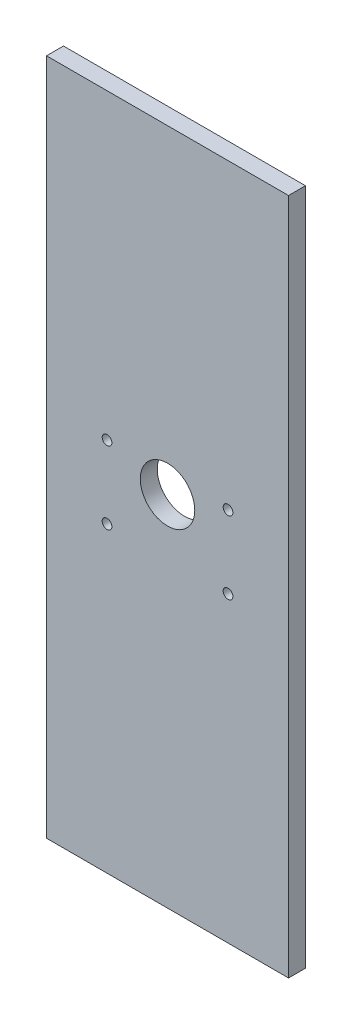
from build123d import *

# Parameters (mm, degrees)
SKETCH1_W           = 127
SKETCH1_H           = 355.6
BOSS_EXTRUDE1_DEPTH = 4.445
SKETCH2_R           = 14.2875
SKETCH2_R_2         = 2.54
CUT_EXTRUDE1_DEPTH  = 190.008259343


with BuildPart() as part:
    # Sketch1 → Boss-Extrude1 (new, symmetric)
    with BuildSketch(Plane.XY):
        Rectangle(SKETCH1_W, SKETCH1_H)
    extrude(amount=BOSS_EXTRUDE1_DEPTH, both=True)

    # Sketch2 → Cut-Extrude1 (cut, through all)
    with BuildSketch(Plane.XY.offset(4.445)):
        with Locations((0, 10.125)):
            Circle(SKETCH2_R)
        with Locations((31.75, 19.05)):
            Circle(SKETCH2_R_2)
        with Locations((31.75, -19.05)):
            Circle(SKETCH2_R_2)
        with Locations((-31.75, -19.05)):
            Circle(SKETCH2_R_2)
        with Locations((-31.75, 19.05)):
            Circle(SKETCH2_R_2)
    extrude(amount=-CUT_EXTRUDE1_DEPTH, mode=Mode.SUBTRACT)


solid = part.part
